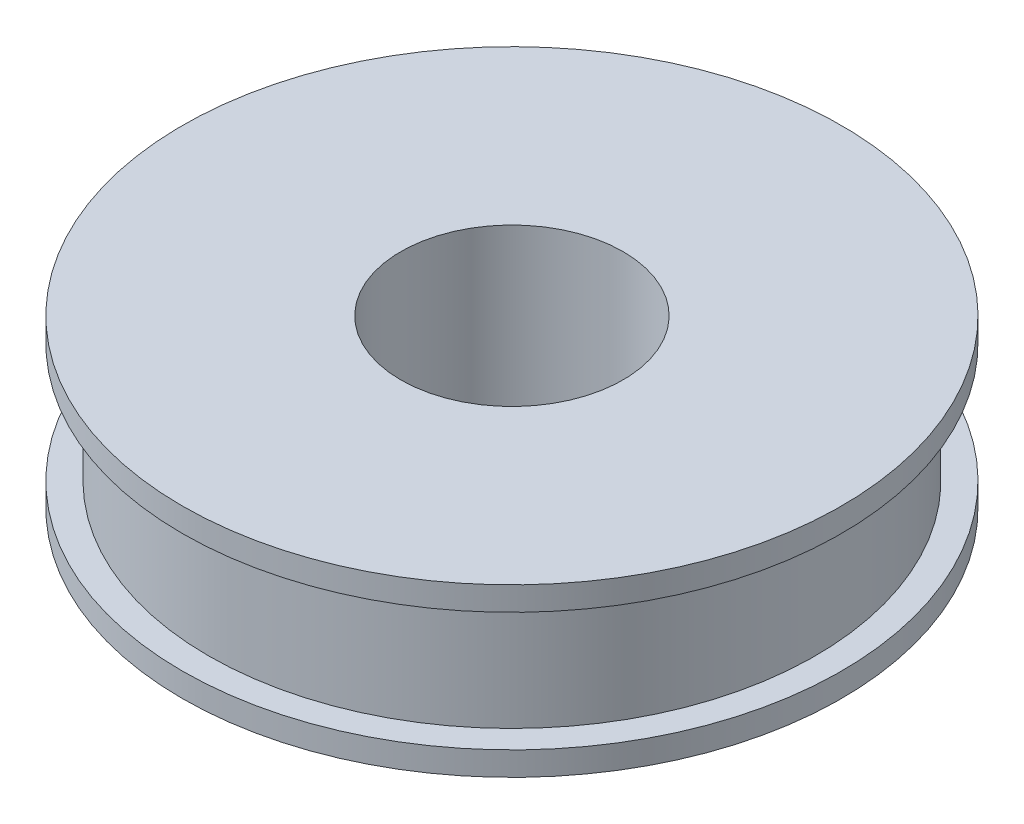
from build123d import *

# Parameters (mm, degrees)
SKETCH1_R           = 41.5
SKETCH1_R_2         = 14
BOSS_EXTRUDE1_DEPTH = 3
SKETCH2_R           = 38.195
SKETCH2_R_2         = 14
BOSS_EXTRUDE2_DEPTH = 15
SKETCH3_R           = 41.5
SKETCH3_R_2         = 14
BOSS_EXTRUDE3_DEPTH = 3


with BuildPart() as part:
    # Sketch1 → Boss-Extrude1 (new body)
    with BuildSketch(Plane(origin=(0, 0, 0), x_dir=(1, 0, 0), z_dir=(0, 1, 0))):
        with Locations(Location((0, 0, 0), (0, 0, 270))):
            Circle(SKETCH1_R)
        with Locations(Location((0, 0, 0), (0, 0, 270))):
            Circle(SKETCH1_R_2, mode=Mode.SUBTRACT)
    extrude(amount=BOSS_EXTRUDE1_DEPTH)

    # Sketch2 → Boss-Extrude2 (add)
    with BuildSketch(Plane(origin=(0, 3, 0), x_dir=(1, 0, 0), z_dir=(0, 1, 0))):
        with Locations(Location((0, 0, 0), (0, 0, 270))):
            Circle(SKETCH2_R)
        with Locations(Location((0, 0, 0), (0, 0, 270))):
            Circle(SKETCH2_R_2, mode=Mode.SUBTRACT)
    extrude(amount=BOSS_EXTRUDE2_DEPTH)

    # Sketch3 → Boss-Extrude3 (add)
    with BuildSketch(Plane(origin=(0, 18, 0), x_dir=(1, 0, 0), z_dir=(0, 1, 0))):
        with Locations(Location((0, 0, 0), (0, 0, 270))):
            Circle(SKETCH3_R)
        with Locations(Location((0, 0, 0), (0, 0, 270))):
            Circle(SKETCH3_R_2, mode=Mode.SUBTRACT)
    extrude(amount=BOSS_EXTRUDE3_DEPTH)


solid = part.part
